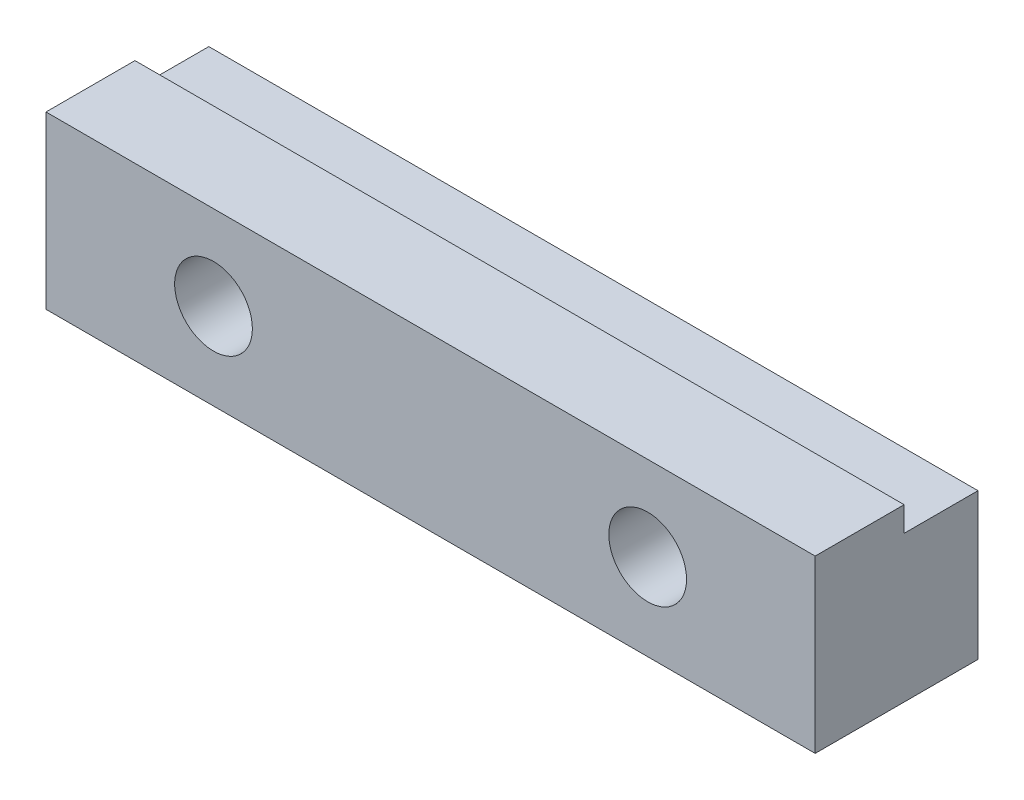
from build123d import *

# Parameters (mm, degrees)
BOSS_EXTRUDE1_DEPTH  = 22.5
MOUNTHOLES_SKETCH_R  = 2.2729
MOUNTHOLES_CUT_DEPTH = 35.322392836


with BuildPart() as part:
    # yExtentCalculator_sketch → Boss-Extrude1 (new, symmetric)
    with BuildSketch(Plane(origin=(0, 0, 0), x_dir=(0, 0, -1), z_dir=(1, 0, 0))):
        Polygon((-9.525, -14.105), (-9.525, -24.105), (0, -24.105), (0, -15.555), (-4.32, -15.555), (-4.32, -14.105), align=None)
    extrude(amount=BOSS_EXTRUDE1_DEPTH, both=True)

    # mountHoles_sketch → mountHoles_cut (cut, through all)
    with BuildSketch(Plane.XY):
        with Locations((12.7, -19.05)):
            Circle(MOUNTHOLES_SKETCH_R)
        with Locations((-12.7, -19.05)):
            Circle(MOUNTHOLES_SKETCH_R)
    extrude(amount=MOUNTHOLES_CUT_DEPTH, mode=Mode.SUBTRACT)


solid = part.part
